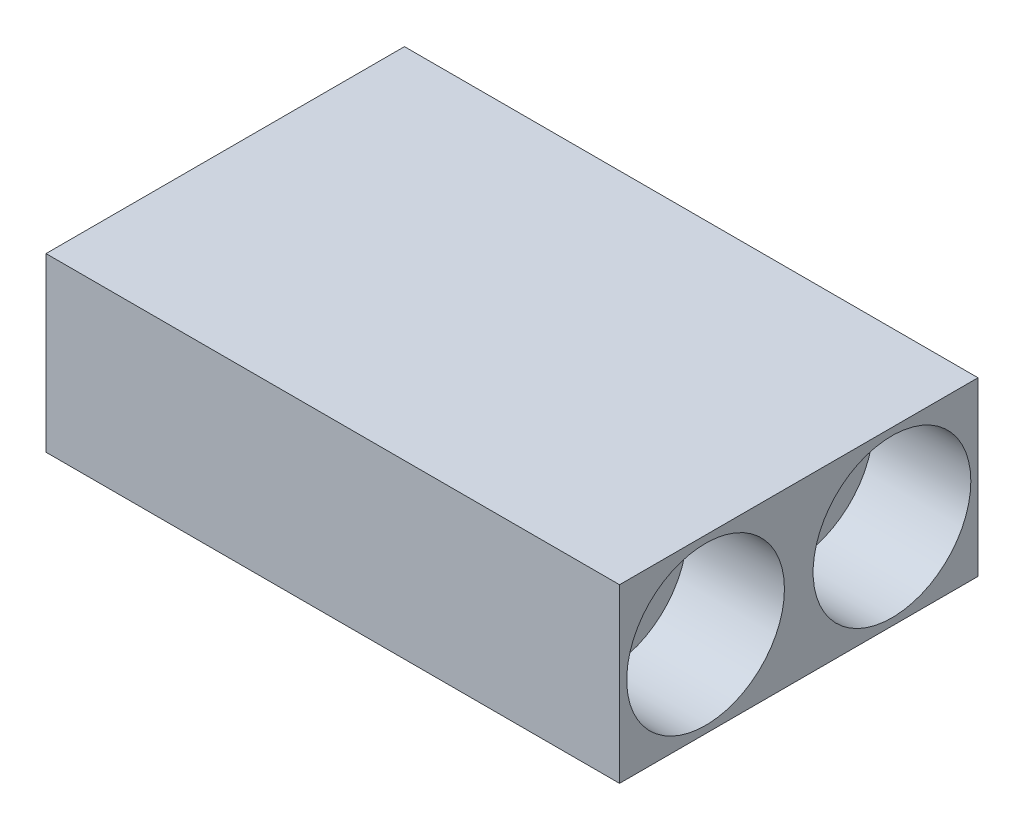
from build123d import *

# Parameters (mm, degrees)
SKETCH_1_W                = 25
SKETCH_1_H                = 12
EXTRUDE_1_DEPTH           = 40
HOLE_WIZARD_1_D           = 6.6
HOLE_WIZARD_1_CBORE_D     = 11
HOLE_WIZARD_1_CBORE_DEPTH = 6.8


with BuildPart() as part:
    # 草图1 → 凸台-拉伸1 (new body)
    with BuildSketch(Plane(origin=(0, 0, 0), x_dir=(0, 0, -1), z_dir=(1, 0, 0))):
        Rectangle(SKETCH_1_W, SKETCH_1_H)
    extrude(amount=EXTRUDE_1_DEPTH)

    # 打孔尺寸根据内六角圆柱头螺钉的类型1 (through all)
    with Locations(Plane(origin=(40, 0, 0), x_dir=(0, 0, -1), z_dir=(1, 0, 0))):
        with Locations((6.5, 0), (-6.5, 0)):
            CounterBoreHole(HOLE_WIZARD_1_D / 2, HOLE_WIZARD_1_CBORE_D / 2, HOLE_WIZARD_1_CBORE_DEPTH)


solid = part.part
